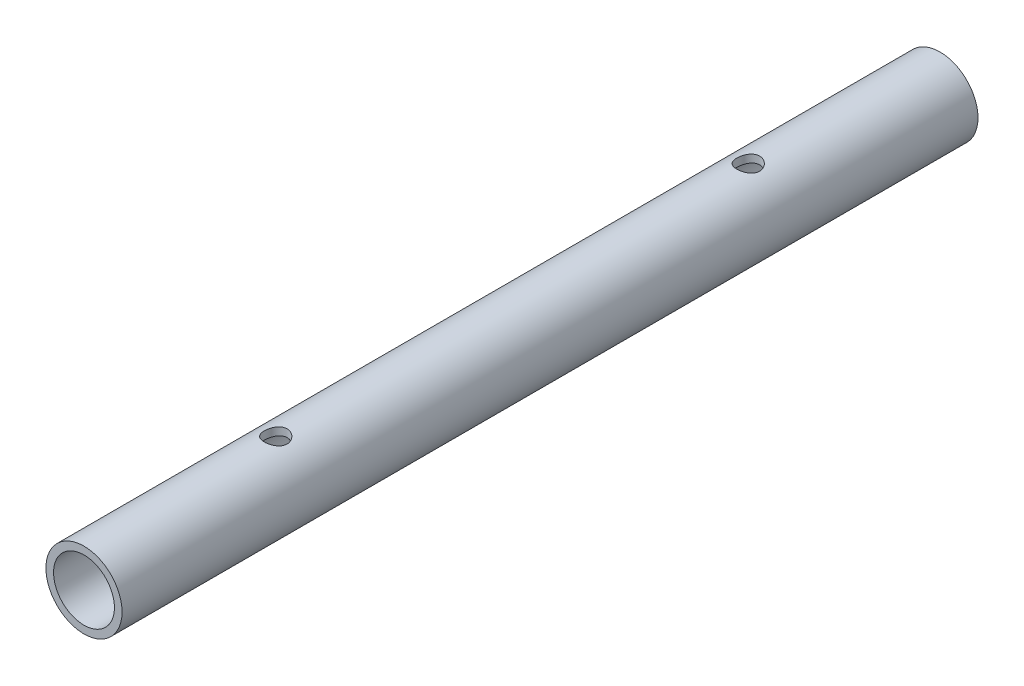
from build123d import *

# Parameters (mm, degrees)
SKETCH1_R               = 5
BOSS_EXTRUDE1_DEPTH     = 112.46
CUT_EXTRUDE1_REACH      = 114.682
SKETCH2_R               = 4
CUT_EXTRUDE2_DEPTH      = 113.682081983
CUT_EXTRUDE2_DEPTH_BACK = 113.682081983
SKETCH5_R               = 1.5


with BuildPart() as part:
    # Sketch1 → Boss-Extrude1 (new body)
    with BuildSketch(Plane.XY):
        Circle(SKETCH1_R)
    extrude(amount=BOSS_EXTRUDE1_DEPTH)

    # Sketch2 → Cut-Extrude1 (cut, up to next)
    with BuildSketch(Plane.XY.offset(112.46), mode=Mode.PRIVATE) as cut_extrude1_sk1:
        Circle(SKETCH2_R)
    cut_extrude1_tool1 = extrude(cut_extrude1_sk1.sketch, amount=-CUT_EXTRUDE1_REACH, mode=Mode.PRIVATE) & part.part
    add(cut_extrude1_tool1.solids().sort_by_distance((0, 0, 112.46))[0], mode=Mode.SUBTRACT)

    # Sketch5 → Cut-Extrude2 (cut, two sides: drawn at the far end of the back side and taken through both)
    with BuildSketch(Plane(origin=(0, 0, 0), x_dir=(1, 0, 0), z_dir=(0, 1, 0)).offset(-CUT_EXTRUDE2_DEPTH_BACK)):
        with Locations(Location((0, -25.191, 0), (0, 0, 270))):
            Circle(SKETCH5_R)
        with Locations(Location((0, -87.269, 0), (0, 0, 270))):
            Circle(SKETCH5_R)
    extrude(amount=CUT_EXTRUDE2_DEPTH + CUT_EXTRUDE2_DEPTH_BACK, mode=Mode.SUBTRACT)


solid = part.part
